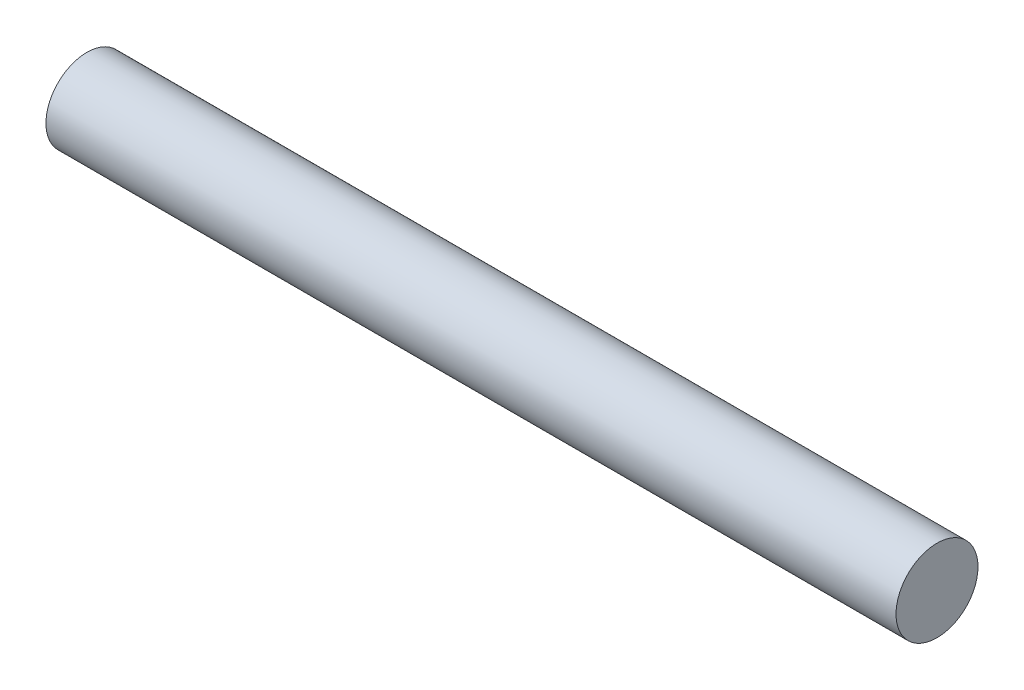
from build123d import *

# Parameters (mm, degrees)
SWEEP1_PROFILE_R = 3.175


with BuildPart() as part:
    # Sweep1: sweep along a curve in space
    with BuildLine() as sweep1_path:
        Line((-169.135499988, -97.75, 219.8250001), (-103.290499988, -97.75, 219.8250001))
    # Sweep1 profile (on start of the path) → Sweep1 (sweep)
    with BuildSketch(Plane(origin=(-169.135499988, -97.75, 219.8250001), x_dir=(0, 1, 0), z_dir=(1, 0, 0))):
        Circle(SWEEP1_PROFILE_R)
    sweep(path=sweep1_path.line)


solid = part.part
